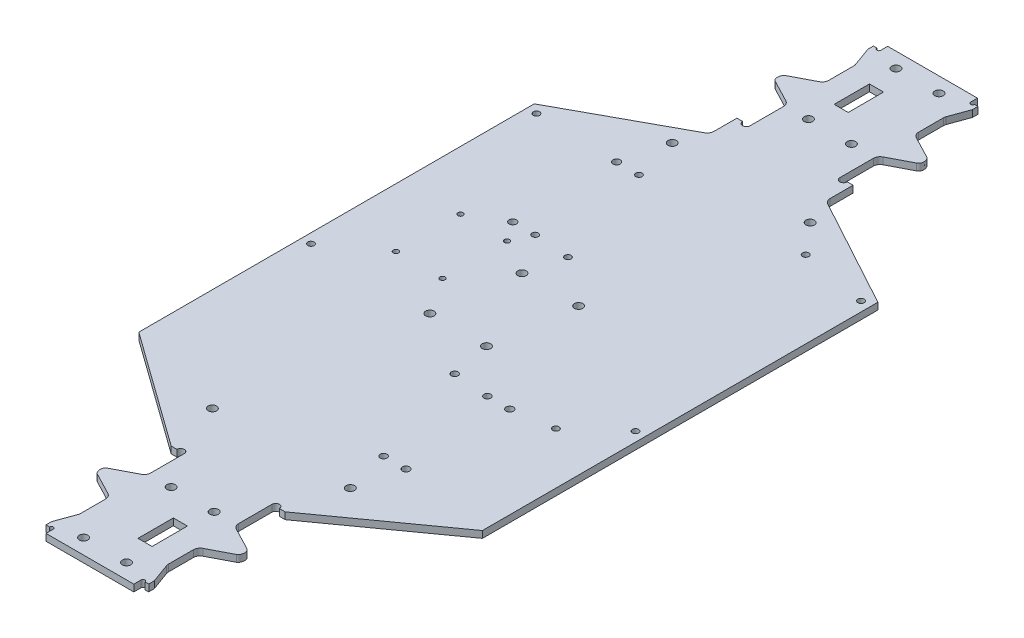
from build123d import *

# Parameters (mm, degrees)
BOSS_EXTRUDE1_DEPTH = 3.175
SKETCH3_R           = 1.9685
SKETCH3_R_2         = 1.7018
SKETCH3_R_3         = 1.4605
SKETCH3_R_4         = 1.5875
SKETCH3_R_5         = 1.4732
SKETCH3_R_6         = 1.2065
SKETCH3_W           = 6.5532
SKETCH3_H           = 16.4592
CUT_EXTRUDE1_DEPTH  = 365.434389894


with BuildPart() as part:
    # Sketch1 → Boss-Extrude1 (new body)
    with BuildSketch(Plane(origin=(0, 0, 0), x_dir=(1, 0, 0), z_dir=(0, 1, 0))):
        with BuildLine():
            Line((20.9042, 21.057301381), (20.9042, 9.500301381))
            ThreePointArc((20.9042, 9.500301381), (21.364503799, 7.853774874), (22.611947739, 6.684667206))
            Line((22.611947739, 6.684667206), (32.903843319, 1.321467969))
            add(Edge.make_bspline(
                [(32.903843319, 1.321467969), (33.614873553, 0.950943726), (34.463414094, -1.137550566), (33.907098259, -2.92148302), (32.903843319, -3.444288181)],
                knots=[0, 0, 0, 0, 0.5, 1, 1, 1, 1], degree=3))
            Line((32.903843319, -3.444288181), (22.611947739, -8.807487419))
            ThreePointArc((22.611947739, -8.807487419), (21.364503799, -9.976595087), (20.9042, -11.623121593))
            Line((20.9042, -11.623121593), (20.9042, -27.172610106))
            ThreePointArc((20.9042, -27.172610106), (22.6441, -28.912510106), (24.384, -27.172610106))
            Line((24.384, -27.172610106), (27.051, -27.172610106))
            Line((27.051, -27.172610106), (27.051, -37.859834638))
            ThreePointArc((27.051, -37.859834638), (27.496194931, -39.48118879), (28.706930259, -40.647854028))
            Line((28.706930259, -40.647854028), (80.01, -68.600651316))
            Line((80.01, -68.600651316), (80.01, -252.750651316))
            Line((80.01, -252.750651316), (26.5303, -291.142539353))
            Line((26.5303, -291.142539353), (23.8379, -291.142539353))
            ThreePointArc((23.8379, -291.142539353), (22.1361, -289.440739353), (20.4343, -291.142539353))
            Line((20.4343, -291.142539353), (20.4343, -306.692027866))
            ThreePointArc((20.4343, -306.692027866), (20.894603799, -308.338554372), (22.142047739, -309.50766204))
            Line((22.142047739, -309.50766204), (32.433943319, -314.870861278))
            add(Edge.make_bspline(
                [(32.433943319, -319.63661747), (33.144973553, -319.266093228), (33.993514113, -317.177598915), (33.437198259, -315.393666439), (32.433943319, -314.870861278)],
                knots=[0, 0, 0, 0, 0.5, 1, 1, 1, 1], degree=3))
            Line((32.433943319, -319.63661747), (22.142047738, -324.999816708))
            ThreePointArc((22.142047738, -324.999816708), (20.894603798, -326.168924376), (20.434299999, -327.815450882))
            Line((20.434299999, -327.815450882), (20.434299999, -339.372450882))
            ThreePointArc((20.434299999, -339.372450882), (20.482218455, -339.921983425), (20.62452741, -340.454928408))
            Line((20.62452741, -340.454928408), (23.888699999, -349.455404296))
            Line((23.888699999, -349.455404296), (23.88337128, -351.995398706))
            Line((23.88337128, -351.995398706), (22.237699999, -352.127939395))
            ThreePointArc((22.237699999, -352.127939395), (21.248038856, -351.230539971), (20.451461278, -352.303022636))
            Line((20.451461278, -352.303022636), (20.451461278, -355.528822636))
            Line((20.451461278, -355.528822636), (-20.451461278, -355.528822636))
            Line((-20.451461278, -355.528822636), (-20.451461278, -352.303022636))
            ThreePointArc((-20.451461278, -352.303022636), (-21.248038856, -351.230539971), (-22.237699999, -352.127939395))
            Line((-22.237699999, -352.127939395), (-23.88337128, -351.995398706))
            Line((-23.88337128, -351.995398706), (-23.888699999, -349.455404296))
            Line((-23.888699999, -349.455404296), (-20.62452741, -340.454928408))
            ThreePointArc((-20.62452741, -340.454928408), (-20.482218455, -339.921983425), (-20.434299999, -339.372450882))
            Line((-20.434299999, -339.372450882), (-20.434299999, -327.815450882))
            ThreePointArc((-20.434299999, -327.815450882), (-20.894603798, -326.168924376), (-22.142047738, -324.999816708))
            Line((-22.142047738, -324.999816708), (-32.433943319, -319.63661747))
            add(Edge.make_bspline(
                [(-32.433943319, -319.63661747), (-33.144973553, -319.266093228), (-33.993514113, -317.177598915), (-33.437198259, -315.393666439), (-32.433943319, -314.870861278)],
                knots=[0, 0, 0, 0, 0.5, 1, 1, 1, 1], degree=3))
            Line((-32.433943319, -314.870861278), (-22.142047739, -309.50766204))
            ThreePointArc((-22.142047739, -309.50766204), (-20.894603799, -308.338554372), (-20.4343, -306.692027866))
            Line((-20.4343, -306.692027866), (-20.4343, -291.142539353))
            ThreePointArc((-20.4343, -291.142539353), (-22.1361, -289.440739353), (-23.8379, -291.142539353))
            Line((-23.8379, -291.142539353), (-26.5303, -291.142539353))
            Line((-26.5303, -291.142539353), (-80.01, -252.750651316))
            Line((-80.01, -252.750651316), (-80.01, -68.600651316))
            Line((-80.01, -68.600651316), (-28.706930259, -40.647854028))
            ThreePointArc((-28.706930259, -40.647854028), (-27.496194931, -39.48118879), (-27.051, -37.859834638))
            Line((-27.051, -37.859834638), (-27.051, -27.172610106))
            Line((-27.051, -27.172610106), (-24.384, -27.172610106))
            ThreePointArc((-24.384, -27.172610106), (-22.6441, -28.912510106), (-20.9042, -27.172610106))
            Line((-20.9042, -27.172610106), (-20.9042, -11.623121593))
            ThreePointArc((-20.9042, -11.623121593), (-21.364503799, -9.976595087), (-22.611947739, -8.807487419))
            Line((-22.611947739, -8.807487419), (-32.903843319, -3.444288181))
            add(Edge.make_bspline(
                [(-32.903843319, 1.321467969), (-33.614873553, 0.950943726), (-34.463414094, -1.137550566), (-33.907098259, -2.92148302), (-32.903843319, -3.444288181)],
                knots=[0, 0, 0, 0, 0.5, 1, 1, 1, 1], degree=3))
            Line((-32.903843319, 1.321467969), (-22.611947739, 6.684667206))
            ThreePointArc((-22.611947739, 6.684667206), (-21.364503799, 7.853774874), (-20.9042, 9.500301381))
            Line((-20.9042, 9.500301381), (-20.9042, 21.057301381))
            ThreePointArc((-20.9042, 21.057301381), (-20.952118456, 21.606833923), (-21.094427411, 22.139778906))
            Line((-21.094427411, 22.139778906), (-24.3586, 31.140254794))
            Line((-24.3586, 31.140254794), (-24.3586, 33.680254794))
            Line((-24.3586, 33.680254794), (-22.7076, 33.680254794))
            ThreePointArc((-22.7076, 33.680254794), (-21.8059, 32.778554794), (-20.9042, 33.680254794))
            Line((-20.9042, 33.680254794), (-20.9042, 36.906054794))
            Line((-20.9042, 36.906054794), (20.9042, 36.906054794))
            Line((20.9042, 36.906054794), (20.9042, 33.680254794))
            ThreePointArc((20.9042, 33.680254794), (21.8059, 32.778554794), (22.7076, 33.680254794))
            Line((22.7076, 33.680254794), (24.3586, 33.680254794))
            Line((24.3586, 33.680254794), (24.3586, 31.140254794))
            Line((24.3586, 31.140254794), (21.094427411, 22.139778906))
            ThreePointArc((21.094427411, 22.139778906), (20.952118456, 21.606833923), (20.9042, 21.057301381))
        make_face()
    extrude(amount=BOSS_EXTRUDE1_DEPTH)

    # Sketch3 → Cut-Extrude1 (cut, through all)
    with BuildSketch(Plane(origin=(0, 3.175, 0), x_dir=(1, 0, 0), z_dir=(0, 1, 0))):
        with Locations(Location((-10.0076, 29.870254794, 0), (0, 0, 270))):
            Circle(SKETCH3_R)
        with Locations(Location((10.0076, 29.870254794, 0), (0, 0, 270))):
            Circle(SKETCH3_R)
        with Locations(Location((-10.0076, -10.922145206, 0), (0, 0, 270))):
            Circle(SKETCH3_R)
        with Locations(Location((10.0076, -10.922145206, 0), (0, 0, 270))):
            Circle(SKETCH3_R)
        with Locations(Location((-32.1183, -52.241120441, 0), (0, 0, 270))):
            Circle(SKETCH3_R)
        with Locations(Location((32.1183, -52.241120441, 0), (0, 0, 270))):
            Circle(SKETCH3_R)
        with Locations(Location((-10.0076, -348.493022636, 0), (0, 0, 270))):
            Circle(SKETCH3_R)
        with Locations(Location((10.0076, -348.493022636, 0), (0, 0, 270))):
            Circle(SKETCH3_R)
        with Locations(Location((10.0076, -307.700622636, 0), (0, 0, 270))):
            Circle(SKETCH3_R)
        with Locations(Location((-10.0076, -307.700622636, 0), (0, 0, 270))):
            Circle(SKETCH3_R)
        with Locations(Location((-32.1183, -266.3816474, 0), (0, 0, 270))):
            Circle(SKETCH3_R)
        with Locations(Location((32.1183, -266.3816474, 0), (0, 0, 270))):
            Circle(SKETCH3_R)
        with Locations(Location((-37.409404629, -72.871310848, 0), (0, 0, 270))):
            Circle(SKETCH3_R_2)
        with Locations(Location((-26.982704629, -72.871310848, 0), (0, 0, 270))):
            Circle(SKETCH3_R_3)
        with Locations(Location((-26.982704629, -121.207510848, 0), (0, 0, 270))):
            Circle(SKETCH3_R_3)
        with Locations(Location((-37.409404629, -121.207510848, 0), (0, 0, 270))):
            Circle(SKETCH3_R_2)
        with Locations(Location((37.409404629, -245.751456994, 0), (0, 0, 270))):
            Circle(SKETCH3_R_2)
        with Locations(Location((26.982704629, -245.751456994, 0), (0, 0, 270))):
            Circle(SKETCH3_R_4)
        with Locations(Location((37.409404629, -197.415256994, 0), (0, 0, 270))):
            Circle(SKETCH3_R_2)
        with Locations(Location((26.982704629, -197.415256994, 0), (0, 0, 270))):
            Circle(SKETCH3_R_4)
        with Locations(Location((-10.328284802, -122.607994505, 0), (0, 0, 270))):
            Circle(SKETCH3_R_3)
        with Locations(Location((10.35451602, -196.005997456, 0), (0, 0, 270))):
            Circle(SKETCH3_R_4)
        with Locations(Location((-14.518992261, -139.79255604, 0), (0, 0, 270))):
            Circle(SKETCH3_R)
        with Locations(Location((11.846207739, -139.79255604, 0), (0, 0, 270))):
            Circle(SKETCH3_R)
        with Locations(Location((6.60405639, -177.453267872, 0), (0, 0, 270))):
            Circle(SKETCH3_R)
        with Locations(Location((-19.76114361, -177.453267872, 0), (0, 0, 270))):
            Circle(SKETCH3_R)
        with Locations(Location((75.565, -72.007264101, 0), (0, 0, 270))):
            Circle(SKETCH3_R_3)
        with Locations(Location((-75.565, -72.007264101, 0), (0, 0, 270))):
            Circle(SKETCH3_R_3)
        with Locations(Location((-75.565, -177.036264101, 0), (0, 0, 270))):
            Circle(SKETCH3_R_3)
        with Locations(Location((75.565, -177.036264101, 0), (0, 0, 270))):
            Circle(SKETCH3_R_3)
        with Locations(Location((44.0563, -66.262403585, 0), (0, 0, 270))):
            Circle(SKETCH3_R_5)
        with Locations(Location((55.9943, -194.532403585, 0), (0, 0, 270))):
            Circle(SKETCH3_R_5)
        with Locations(Location((-52.679777995, -130.268623082, 0), (0, 0, 270))):
            Circle(SKETCH3_R_6)
        with Locations(Location((-30.988177995, -130.268623082, 0), (0, 0, 270))):
            Circle(SKETCH3_R_6)
        with Locations(Location((-52.679777995, -160.367623082, 0), (0, 0, 270))):
            Circle(SKETCH3_R_6)
        with Locations(Location((-30.988177995, -160.367623082, 0), (0, 0, 270))):
            Circle(SKETCH3_R_6)
        with Locations((-6.7056, 9.245454794)):
            Rectangle(SKETCH3_W, SKETCH3_H)
        with Locations((6.235699999, -327.868222636)):
            Rectangle(SKETCH3_W, SKETCH3_H)
    extrude(amount=-CUT_EXTRUDE1_DEPTH, mode=Mode.SUBTRACT)


solid = part.part
